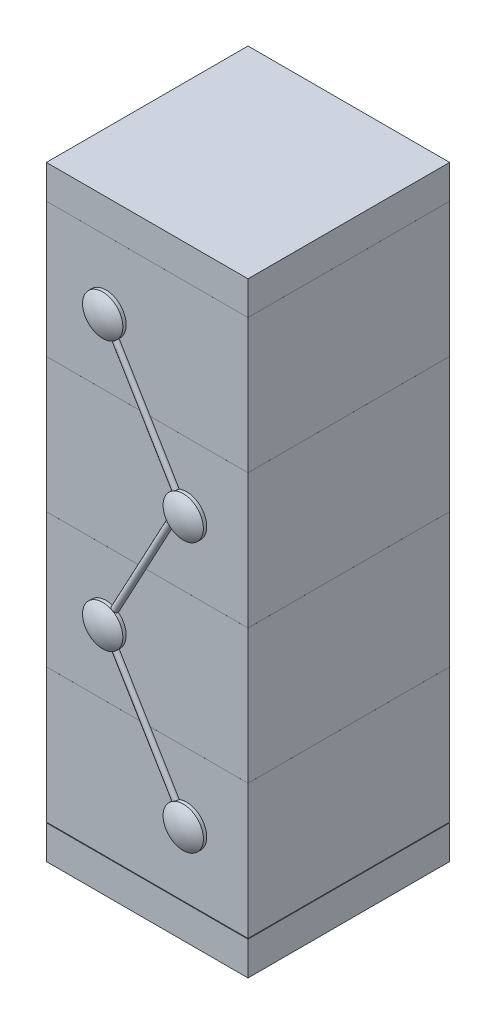
from build123d import *

# Parameters (mm, degrees)
SKETCH1_W           = 3
SKETCH1_H           = 3
BOSS_EXTRUDE1_DEPTH = 2
LPATTERN3_COUNT     = 4
LPATTERN3_PITCH     = 2.0001
SKETCH2_W           = 3
SKETCH2_H           = 3
BOSS_EXTRUDE2_DEPTH = 0.5
SKETCH7_R           = 0.3
BOSS_EXTRUDE6_DEPTH = 0.05
DOME1_FACE_RADIUS   = 0.3
DOME1_HEIGHT        = 0.1
DOME5_FACE_RADIUS   = 0.3
DOME5_HEIGHT        = 0.1
DOME6_FACE_RADIUS   = 0.3
DOME6_HEIGHT        = 0.1
DOME7_FACE_RADIUS   = 0.3
DOME7_HEIGHT        = 0.1
SKETCH9_R           = 0.05
SKETCH34_W          = 3
SKETCH34_H          = 3
BOSS_EXTRUDE7_DEPTH = 0.5


with BuildPart() as part:
    # Sketch1 → Boss-Extrude1 (new body)
    with BuildSketch(Plane(origin=(0, 0, 0), x_dir=(1, 0, 0), z_dir=(0, 1, 0))):
        Rectangle(SKETCH1_W, SKETCH1_H)
    extrude(amount=BOSS_EXTRUDE1_DEPTH)


with BuildPart() as lpattern3_1:
    # LPattern3: pattern copy
    add(part.part.moved(Location(Vector(0, 1, 0) * (1 * LPATTERN3_PITCH))))


with BuildPart() as lpattern3_2:
    # LPattern3: pattern copy
    add(part.part.moved(Location(Vector(0, 1, 0) * (2 * LPATTERN3_PITCH))))


with BuildPart() as lpattern3_3:
    # LPattern3: pattern copy
    add(part.part.moved(Location(Vector(0, 1, 0) * (3 * LPATTERN3_PITCH))))

    # Sketch7 → Boss-Extrude6 (add)
    with BuildSketch(Plane.XY.offset(1.5)):
        with Locations(Location((-0.612484748, 7.0003, 0), (0, 0, 180))):
            Circle(SKETCH7_R)
        with Locations((0.586205547, 5.0002)):
            Circle(SKETCH7_R)
        with Locations((-0.612484748, 3.0001)):
            Circle(SKETCH7_R)
        with Locations((0.586205547, 1)):
            Circle(SKETCH7_R)
    extrude(amount=BOSS_EXTRUDE6_DEPTH)


with BuildPart() as body_5:
    # Sketch2 → Boss-Extrude2 (new body)
    with BuildSketch(Plane(origin=(0, -0.01, 0), x_dir=(-1, 0, 0), z_dir=(0, -1, 0))):
        Rectangle(SKETCH2_W, SKETCH2_H)
    extrude(amount=BOSS_EXTRUDE2_DEPTH)


with BuildPart() as boss_extrude6_piece_1:
    # of the separate pieces the step leaves, piece 1, a body of its own (boss_extrude6_pieces)
    add(lpattern3_3.part.solids().sort_by_distance((-1.5, 6.0003, -1.5))[0])

    # Dome1: a dome of height H over a round flat face of radius A is a cap of a sphere of radius (A * A + H * H) / (2 * H)
    dome1_r = (DOME1_FACE_RADIUS * DOME1_FACE_RADIUS + DOME1_HEIGHT * DOME1_HEIGHT) / (2 * DOME1_HEIGHT)
    dome1_base = Plane((-0.612484748, 7.0003, 1.55), z_dir=(0, 0, 1))
    with Locations(dome1_base.offset(DOME1_HEIGHT - dome1_r)):
        dome1_ball = Sphere(dome1_r, mode=Mode.PRIVATE)
    add(split(dome1_ball, bisect_by=dome1_base, keep=Keep.TOP, mode=Mode.PRIVATE))


with BuildPart() as boss_extrude6_piece_2:
    # of the separate pieces the step leaves, piece 2, a body of its own (boss_extrude6_pieces)
    add(lpattern3_3.part.solids().sort_by_distance((0.886205547, 5.0002, 1.5))[0])

    # Dome5: a dome of height H over a round flat face of radius A is a cap of a sphere of radius (A * A + H * H) / (2 * H)
    dome5_r = (DOME5_FACE_RADIUS * DOME5_FACE_RADIUS + DOME5_HEIGHT * DOME5_HEIGHT) / (2 * DOME5_HEIGHT)
    dome5_base = Plane((0.586205547, 5.0002, 1.55), z_dir=(0, 0, 1))
    with Locations(dome5_base.offset(DOME5_HEIGHT - dome5_r)):
        dome5_ball = Sphere(dome5_r, mode=Mode.PRIVATE)
    add(split(dome5_ball, bisect_by=dome5_base, keep=Keep.TOP, mode=Mode.PRIVATE))


with BuildPart() as boss_extrude6_piece_3:
    # of the separate pieces the step leaves, piece 3, a body of its own (boss_extrude6_pieces)
    add(lpattern3_3.part.solids().sort_by_distance((0.886205547, 1, 1.5))[0])

    # Dome7: a dome of height H over a round flat face of radius A is a cap of a sphere of radius (A * A + H * H) / (2 * H)
    dome7_r = (DOME7_FACE_RADIUS * DOME7_FACE_RADIUS + DOME7_HEIGHT * DOME7_HEIGHT) / (2 * DOME7_HEIGHT)
    dome7_base = Plane((0.586205547, 1, 1.55), z_dir=(0, 0, 1))
    with Locations(dome7_base.offset(DOME7_HEIGHT - dome7_r)):
        dome7_ball = Sphere(dome7_r, mode=Mode.PRIVATE)
    add(split(dome7_ball, bisect_by=dome7_base, keep=Keep.TOP, mode=Mode.PRIVATE))


with BuildPart() as boss_extrude6_piece_4:
    # of the separate pieces the step leaves, piece 4, a body of its own (boss_extrude6_pieces)
    add(lpattern3_3.part.solids().sort_by_distance((-0.312484748, 3.0001, 1.5))[0])

    # Dome6: a dome of height H over a round flat face of radius A is a cap of a sphere of radius (A * A + H * H) / (2 * H)
    dome6_r = (DOME6_FACE_RADIUS * DOME6_FACE_RADIUS + DOME6_HEIGHT * DOME6_HEIGHT) / (2 * DOME6_HEIGHT)
    dome6_base = Plane((-0.612484748, 3.0001, 1.55), z_dir=(0, 0, 1))
    with Locations(dome6_base.offset(DOME6_HEIGHT - dome6_r)):
        dome6_ball = Sphere(dome6_r, mode=Mode.PRIVATE)
    add(split(dome6_ball, bisect_by=dome6_base, keep=Keep.TOP, mode=Mode.PRIVATE))


with BuildPart() as part_1:
    add(part.part)

    add(lpattern3_1.part)  # Sweep1 merges LPattern3_1

    add(lpattern3_2.part)  # Sweep1 merges LPattern3_2

    add(boss_extrude6_piece_1.part)  # Sweep1 merges Boss-Extrude6 piece 1

    add(boss_extrude6_piece_2.part)  # Sweep1 merges Boss-Extrude6 piece 2

    add(boss_extrude6_piece_3.part)  # Sweep1 merges Boss-Extrude6 piece 3

    add(boss_extrude6_piece_4.part)  # Sweep1 merges Boss-Extrude6 piece 4
    # Sweep1: sweep along a path in Sketch8
    with BuildLine(Plane.XY.offset(1.5)) as sweep1_path:
        Line((-0.612484748, 7.0003), (0.521304183, 5.108492541))
        Line((0.521304183, 5.108492541), (-0.612484748, 3.0001))
        Line((-0.612484748, 3.0001), (0.586205547, 1))
    # Sketch9 → Sweep1 (sweep)
    with BuildSketch(Plane(origin=(-0.612484748, 7.0003, 1.5), x_dir=(0, 0, -1), z_dir=(0.5140637754126949, -0.8577519657852418, 0))):
        Circle(SKETCH9_R)
    sweep(path=sweep1_path.line, transition=Transition.RIGHT)


with BuildPart() as body_3:
    # Sketch34 → Boss-Extrude7 (new body)
    with BuildSketch(Plane(origin=(0, 8.0004, 0), x_dir=(1, 0, 0), z_dir=(0, 1, 0))):
        Rectangle(SKETCH34_W, SKETCH34_H)
    extrude(amount=BOSS_EXTRUDE7_DEPTH)


solid = Compound([body_5.part, part_1.part, body_3.part])
